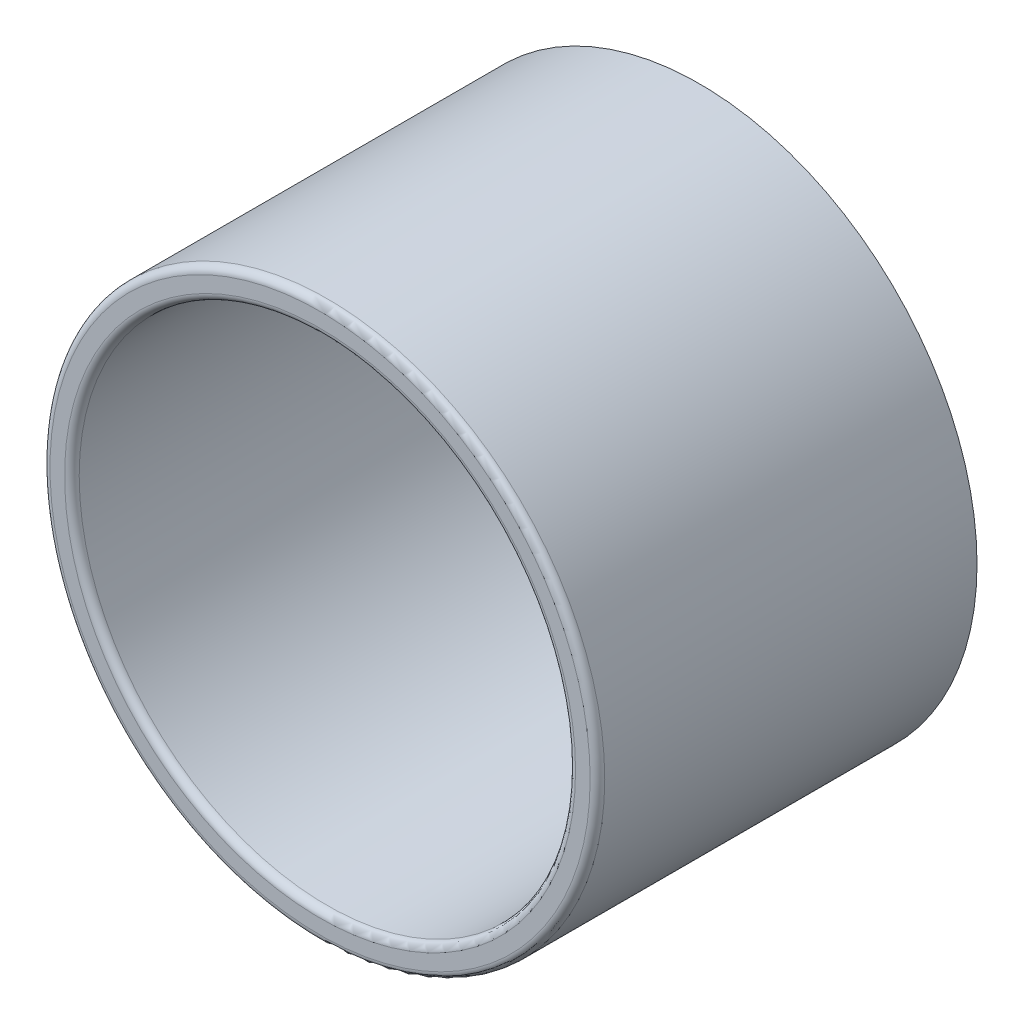
from build123d import *

# Parameters (mm, degrees)
SKETCH1_R           = 19
SKETCH1_R_2         = 17
BOSS_EXTRUDE1_DEPTH = 26
FILLET1_R           = 0.5


with BuildPart() as part:
    # Sketch1 → Boss-Extrude1 (new body)
    with BuildSketch(Plane.XY):
        Circle(SKETCH1_R)
        Circle(SKETCH1_R_2, mode=Mode.SUBTRACT)
    extrude(amount=-BOSS_EXTRUDE1_DEPTH)

    # Fillet1
    fillet1_edges = [part.edges().sort_by_distance(p)[0] for p in [
        (-19, 0, 0),
        (-17, 0, 0),
    ]]
    fillet(fillet1_edges, radius=FILLET1_R)


solid = part.part
